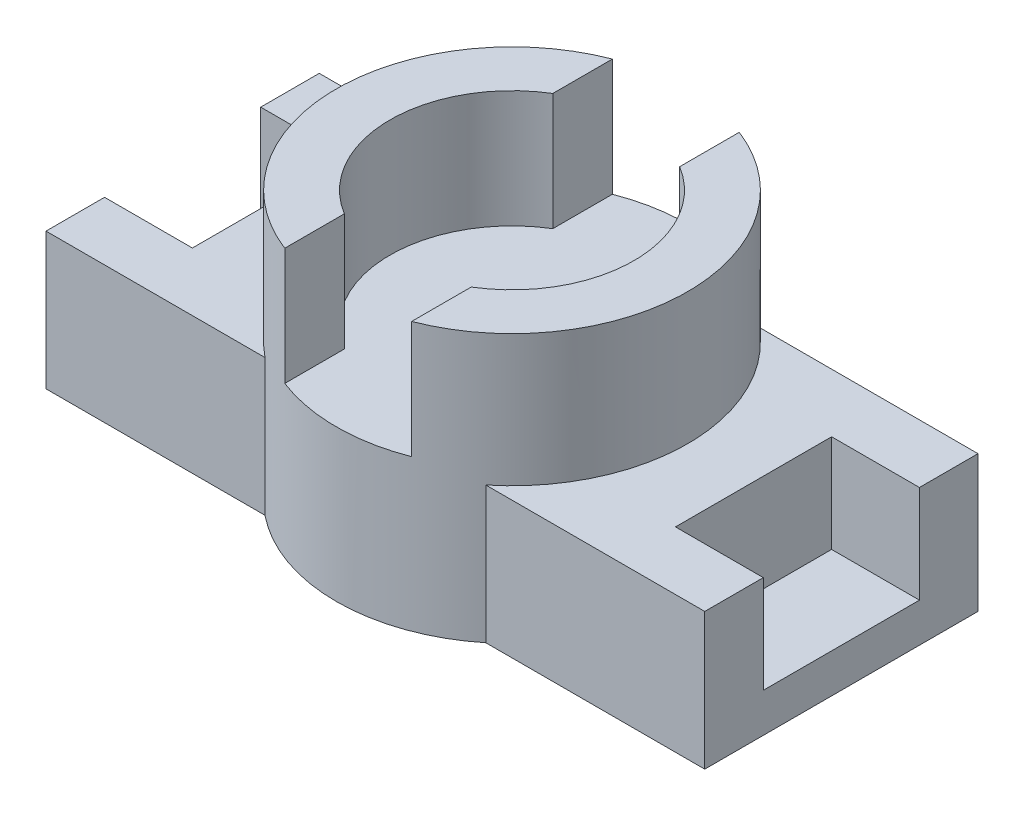
from build123d import *

# Parameters (mm, degrees)
SKETCH1_W           = 135
SKETCH1_H           = 56
BOSS_EXTRUDE1_DEPTH = 28
SKETCH2_R           = 36
BOSS_EXTRUDE2_DEPTH = 55
SKETCH3_W           = 18
SKETCH3_H           = 32
CUT_EXTRUDE1_DEPTH  = 20
CUT_EXTRUDE2_START  = -24
CUT_EXTRUDE2_DEPTH  = 24


with BuildPart() as part:
    # Sketch1 → Boss-Extrude1 (new body)
    with BuildSketch(Plane(origin=(0, 0, 0), x_dir=(1, 0, 0), z_dir=(0, 1, 0))):
        Rectangle(SKETCH1_W, SKETCH1_H)
    extrude(amount=BOSS_EXTRUDE1_DEPTH)

    # Sketch2 → Boss-Extrude2 (add)
    with BuildSketch(Plane(origin=(0, 0, 0), x_dir=(1, 0, 0), z_dir=(0, 1, 0))):
        with Locations(Location((0, 0, 0), (0, 0, 51.057558731))):
            Circle(SKETCH2_R)
    extrude(amount=BOSS_EXTRUDE2_DEPTH)

    # Sketch3 → Cut-Extrude1 (cut)
    with BuildSketch(Plane(origin=(0, 28, 0), x_dir=(1, 0, 0), z_dir=(0, 1, 0))):
        with Locations((-58.5, 0)):
            Rectangle(SKETCH3_W, SKETCH3_H)
    cut_extrude1 = extrude(amount=-CUT_EXTRUDE1_DEPTH, mode=Mode.SUBTRACT)

    # Mirror1: Cut-Extrude1 across plane
    add(cut_extrude1.mirror(Plane(origin=(0, 0, 0), x_dir=(0, 0, 1), z_dir=(1, 0, 0))), mode=Mode.SUBTRACT)

    # Sketch4 → Cut-Extrude2 (cut)
    with BuildSketch(Plane(origin=(0, 55, 0), x_dir=(1, 0, 0), z_dir=(0, 1, 0)).offset(CUT_EXTRUDE2_START)):
        with BuildLine():
            Line((-13, 33.570820663), (-13, 21.354156504))
            ThreePointArc((-13, 21.354156504), (-25, 0), (-13, -21.354156504))
            Line((-13, -21.354156504), (-13, -33.570820663))
            ThreePointArc((-13, -33.570820663), (0, -36), (13, -33.570820663))
            Line((13, -33.570820663), (13, -21.354156504))
            ThreePointArc((13, -21.354156504), (25, 0), (13, 21.354156504))
            Line((13, 21.354156504), (13, 33.570820663))
            ThreePointArc((13, 33.570820663), (0, 36), (-13, 33.570820663))
        make_face()
    extrude(amount=CUT_EXTRUDE2_DEPTH, mode=Mode.SUBTRACT)


solid = part.part
